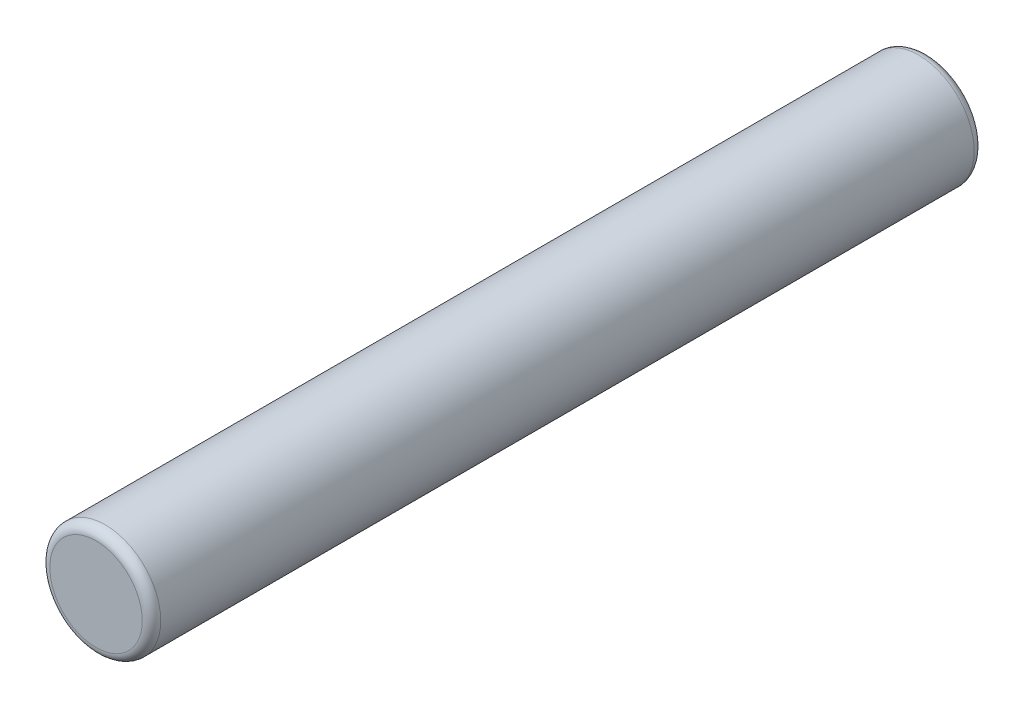
from build123d import *

# Parameters (mm, degrees)
SKETCH1_R           = 3
BOSS_EXTRUDE1_DEPTH = 22.5
FILLET1_R           = 0.5


with BuildPart() as part:
    # Sketch1 → Boss-Extrude1 (new, symmetric)
    with BuildSketch(Plane.XY):
        with Locations(Location((0, 0, 0), (0, 0, 180))):
            Circle(SKETCH1_R)
    extrude(amount=BOSS_EXTRUDE1_DEPTH, both=True)

    # Fillet1
    fillet1_edges = [part.edges().sort_by_distance(p)[0] for p in [
        (3, 0, -22.5),
        (3, 0, 22.5),
    ]]
    fillet(fillet1_edges, radius=FILLET1_R)


solid = part.part
